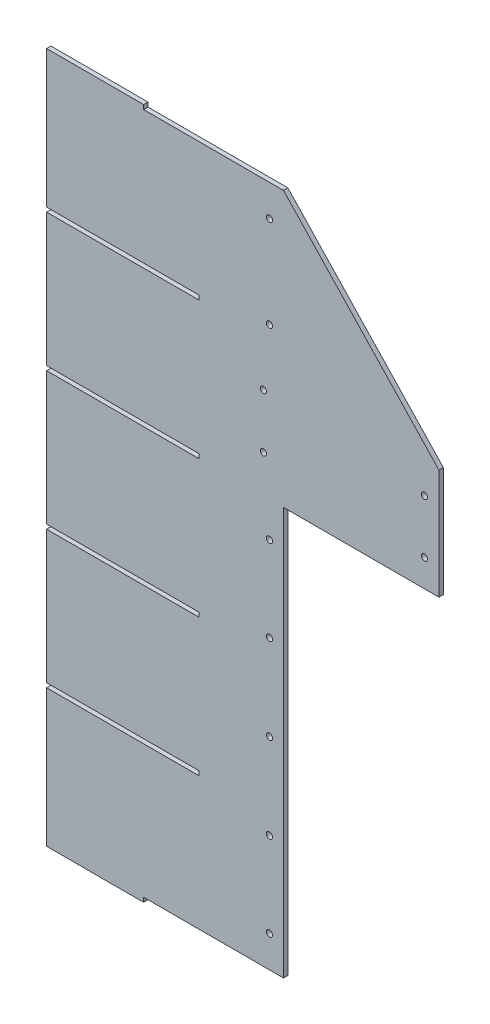
from build123d import *

# Parameters (mm, degrees)
BOSS_EXTRUDE2_DEPTH = 3.175
BOSS_EXTRUDE3_DEPTH = 3.175
BOSS_EXTRUDE8_DEPTH = 3.175
SKETCH12_W          = 70.49262
SKETCH12_H          = 3.175
BOSS_EXTRUDE9_DEPTH = 3.175
SKETCH15_R          = 2.25
CUT_EXTRUDE1_DEPTH  = 371.49176257
SKETCH16_R          = 2.250000072
SKETCH16_R_2        = 2.25
CUT_EXTRUDE2_DEPTH  = 371.49176257


with BuildPart() as part:
    # Sketch1 → Boss-Extrude2 (new body)
    with BuildSketch(Plane.XY):
        Polygon((129.013076168, 254.245404572), (-18.685383832, 254.245404572), (-18.685383832, 157.666984572), (92.088461168, 157.666984572), (92.088461168, 154.491984572), (-18.685383832, 154.491984572), (-18.685383832, 57.913564572), (92.088461168, 57.913564572), (92.088461168, 54.738564572), (-18.685383832, 54.738564572), (-18.685383832, -41.839855428), (92.088461168, -41.839855428), (92.088461168, -45.014855428), (-18.685383832, -45.014855428), (-18.685383832, -141.593275428), (92.088461168, -141.593275428), (92.088461168, -144.768275428), (-18.685383832, -144.768275428), (-18.685383832, -241.346695428), (129.013076168, -241.346695428), align=None)
    extrude(amount=BOSS_EXTRUDE2_DEPTH)

    # Sketch4 → Boss-Extrude3 (add, through all)
    with BuildSketch(Plane.XY.offset(3.175)):
        Polygon((129.013076168, 254.245404572), (129.013076168, -241.346695428), (153.407236168, -241.346695428), (153.407236168, -227.262720585), (153.407236168, 240.16142973), (153.407236168, 254.245404572), align=None)
    extrude(amount=-BOSS_EXTRUDE3_DEPTH)

    # Sketch11 → Boss-Extrude8 (add, through all)
    with BuildSketch(Plane.XY.offset(3.175)):
        Polygon((266.437236168, 134.679984572), (266.437236168, 54.738564572), (153.407236168, 54.738564572), (153.407236168, 134.679984572), (153.407236168, 254.245404572), align=None)
    extrude(amount=-BOSS_EXTRUDE8_DEPTH)

    # Sketch12 → Boss-Extrude9 (add, through all)
    with BuildSketch(Plane(origin=(0, 0, 0), x_dir=(-1, 0, 0), z_dir=(0, 0, -1))):
        with Locations((-16.560926168, 255.832904572)):
            Rectangle(SKETCH12_W, SKETCH12_H)
        with Locations((-16.560926168, -242.934195428)):
            Rectangle(SKETCH12_W, SKETCH12_H)
    extrude(amount=-BOSS_EXTRUDE9_DEPTH)

    # Sketch15 → Cut-Extrude1 (cut, through all)
    with BuildSketch(Plane.XY.offset(3.175)):
        with Locations((143.247236168, 231.313297791)):
            Circle(SKETCH15_R)
        with Locations((143.247236168, 164.651984572)):
            Circle(SKETCH15_R)
        with Locations((255.799716168, 113.343984572)):
            Circle(SKETCH15_R)
        with Locations((255.799716168, 74.495671354)):
            Circle(SKETCH15_R)
        with Locations((143.247236168, 29.338564572)):
            Circle(SKETCH15_R)
        with Locations((143.247236168, -32.334232694)):
            Circle(SKETCH15_R)
        with Locations((143.247236168, -94.538012037)):
            Circle(SKETCH15_R)
        with Locations((143.247236168, -156.74179138)):
            Circle(SKETCH15_R)
        with Locations((143.247236168, -218.414588646)):
            Circle(SKETCH15_R)
    extrude(amount=-CUT_EXTRUDE1_DEPTH, mode=Mode.SUBTRACT)

    # Sketch16 → Cut-Extrude2 (cut, through all)
    with BuildSketch(Plane.XY.offset(3.175)):
        with Locations((138.792076168, 121.451235566)):
            Circle(SKETCH16_R)
        with Locations((138.792076168, 82.140925566)):
            Circle(SKETCH16_R_2)
    extrude(amount=-CUT_EXTRUDE2_DEPTH, mode=Mode.SUBTRACT)


solid = part.part
